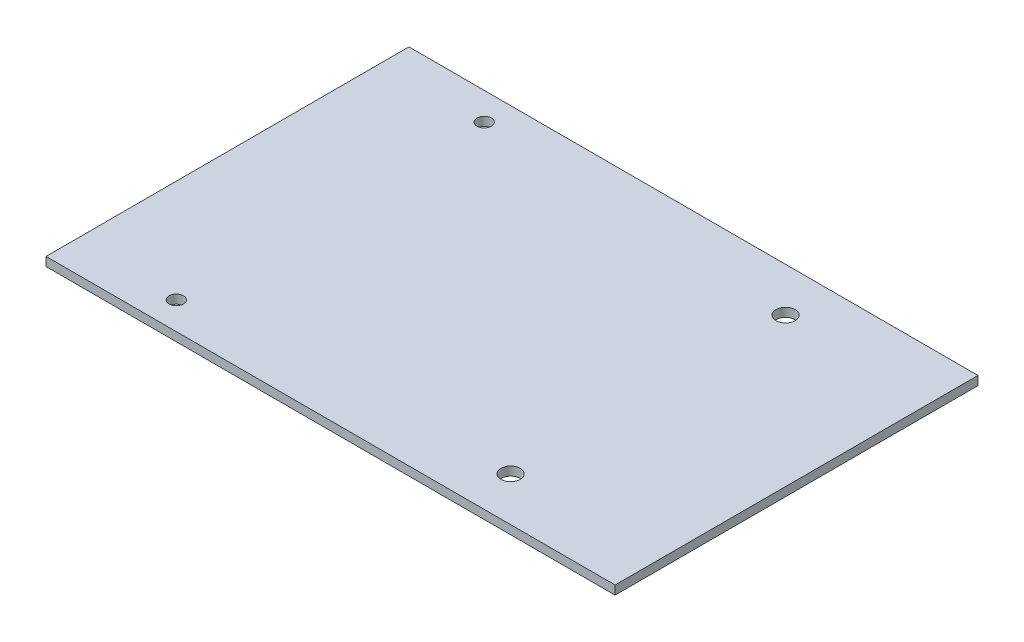
from build123d import *

# Parameters (mm, degrees)
SKETCH1_W           = 103.5
SKETCH1_H           = 66
BOSS_EXTRUDE1_DEPTH = 1.6
SKETCH3_R           = 1.3
CUT_EXTRUDE2_DEPTH  = 10
CUT_EXTRUDE3_REACH  = 63.397
SKETCH4_R           = 1.75


with BuildPart() as part:
    # Sketch1 → Boss-Extrude1 (new body)
    with BuildSketch(Plane(origin=(0, 0, 0), x_dir=(1, 0, 0), z_dir=(0, 1, 0))):
        Rectangle(SKETCH1_W, SKETCH1_H)
    extrude(amount=BOSS_EXTRUDE1_DEPTH)

    # Sketch3 → Cut-Extrude2 (cut)
    with BuildSketch(Plane(origin=(0, 1.6, 0), x_dir=(1, 0, 0), z_dir=(0, 1, 0))):
        with Locations(Location((-33.052335, 28, 0), (0, 0, 270))):
            Circle(SKETCH3_R)
        with Locations(Location((-33.052335, -28, 0), (0, 0, 270))):
            Circle(SKETCH3_R)
    extrude(amount=-CUT_EXTRUDE2_DEPTH, mode=Mode.SUBTRACT)

    # Sketch4 → Cut-Extrude3 (cut, up to next)
    with BuildSketch(Plane(origin=(0, 1.6, 0), x_dir=(1, 0, 0), z_dir=(0, 1, 0)), mode=Mode.PRIVATE) as cut_extrude3_sk1:
        with Locations(Location((24.75, 25, 0), (0, 0, 270))):
            Circle(SKETCH4_R)
    cut_extrude3_tool1 = extrude(cut_extrude3_sk1.sketch, amount=-CUT_EXTRUDE3_REACH, mode=Mode.PRIVATE) & part.part
    # Sketch4 → Cut-Extrude3 (cut, up to next)
    with BuildSketch(Plane(origin=(0, 1.6, 0), x_dir=(1, 0, 0), z_dir=(0, 1, 0)), mode=Mode.PRIVATE) as cut_extrude3_sk2:
        with Locations(Location((24.75, -25, 0), (0, 0, 270))):
            Circle(SKETCH4_R)
    cut_extrude3_tool2 = extrude(cut_extrude3_sk2.sketch, amount=-CUT_EXTRUDE3_REACH, mode=Mode.PRIVATE) & part.part
    add(cut_extrude3_tool1.solids().sort_by_distance((24.75, 1.6, -25))[0], mode=Mode.SUBTRACT)
    add(cut_extrude3_tool2.solids().sort_by_distance((24.75, 1.6, 25))[0], mode=Mode.SUBTRACT)


solid = part.part
